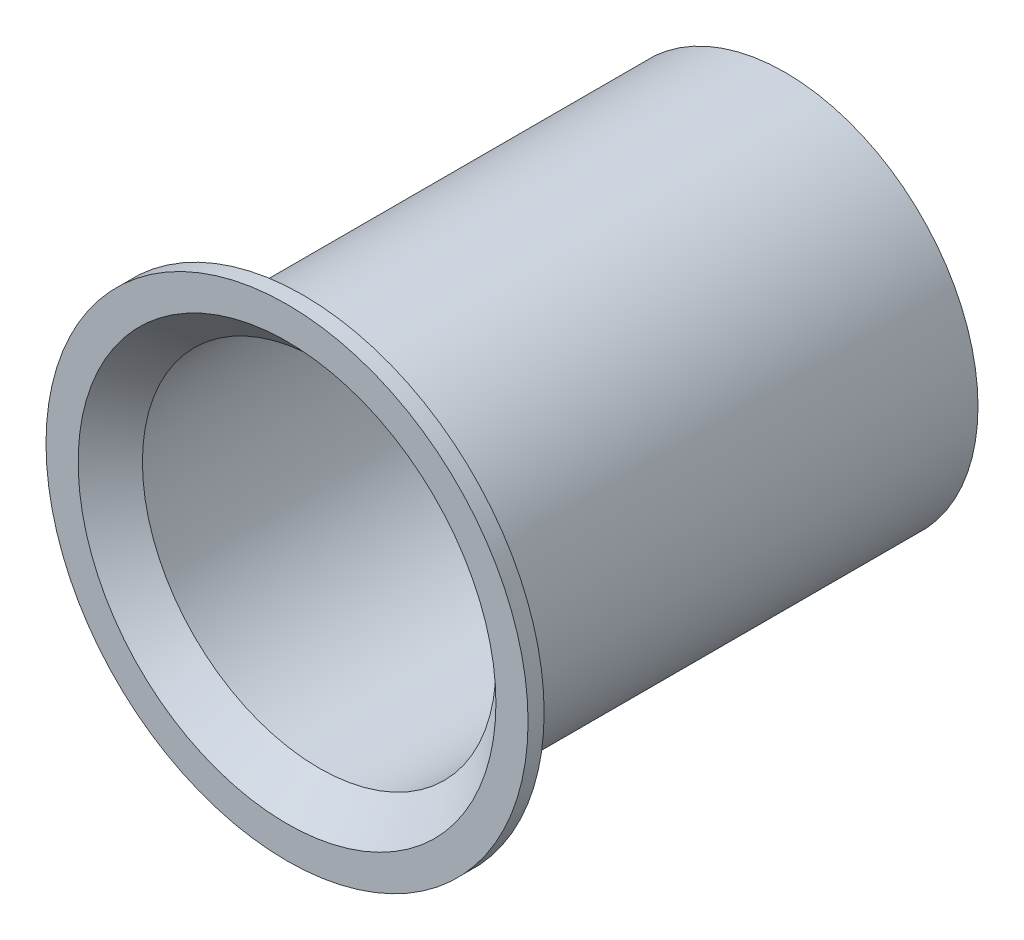
from build123d import *

# Parameters (mm, degrees)
SKETCH1_R           = 7.5
BOSS_EXTRUDE1_DEPTH = 0.5
SKETCH2_R           = 6
BOSS_EXTRUDE2_DEPTH = 15
SKETCH3_R           = 5.5
CUT_EXTRUDE1_DEPTH  = 19.781639971
CHAMFER1_SIZE       = 1


with BuildPart() as part:
    # Sketch1 → Boss-Extrude1 (new body)
    with BuildSketch(Plane.XY):
        Circle(SKETCH1_R)
    extrude(amount=BOSS_EXTRUDE1_DEPTH)

    # Sketch2 → Boss-Extrude2 (add)
    with BuildSketch(Plane(origin=(0, 0, 0), x_dir=(-1, 0, 0), z_dir=(0, 0, -1))):
        Circle(SKETCH2_R)
    extrude(amount=BOSS_EXTRUDE2_DEPTH)

    # Sketch3 → Cut-Extrude1 (cut, through all)
    with BuildSketch(Plane.XY.offset(0.5)):
        Circle(SKETCH3_R)
    extrude(amount=-CUT_EXTRUDE1_DEPTH, mode=Mode.SUBTRACT)

    # Chamfer1
    chamfer1_edges = [part.edges().sort_by_distance(p)[0] for p in [
        (-5.5, 0, 0.5),
        (6, 0, 0),
    ]]
    chamfer(chamfer1_edges, length=CHAMFER1_SIZE)


solid = part.part
